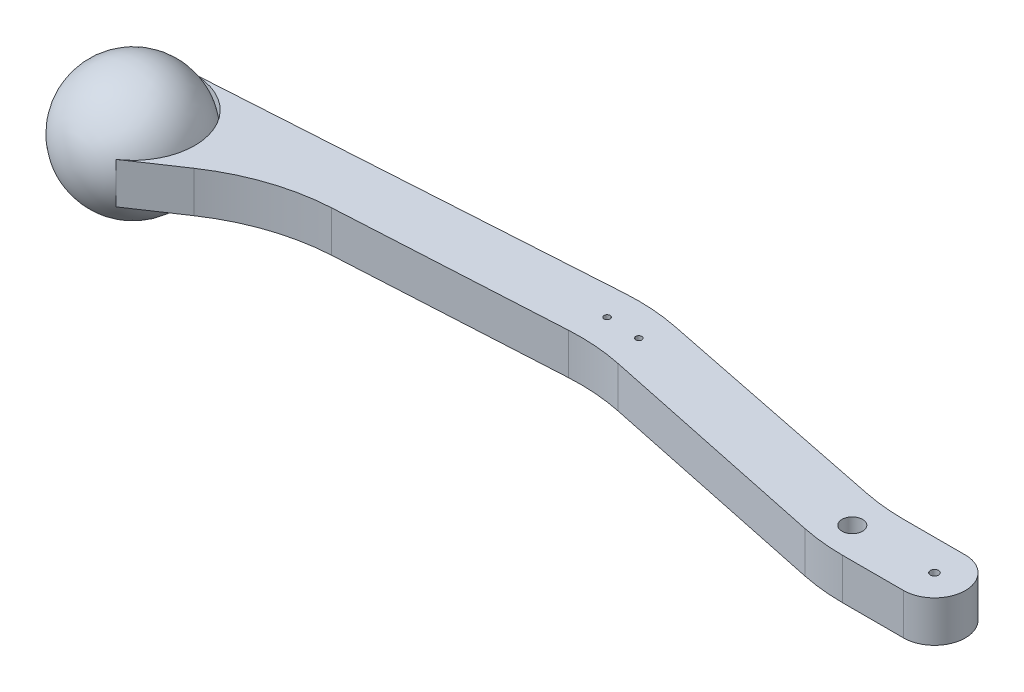
from build123d import *

# Parameters (mm, degrees)
BOSS_EXTRUDE1_DEPTH      = 10
BOSS_EXTRUDE1_DEPTH_BACK = 10
SKETCH1_R                = 5
SKETCH1_R_2              = 2
FILLET1_R                = 100
SKETCH2_R                = 1.5
CUT_EXTRUDE1_DEPTH       = 10
CUT_EXTRUDE2_DEPTH       = 10
CUT_EXTRUDE2_DEPTH_BACK  = 10
SKETCH3_R                = 30


with BuildPart() as part:
    # Sketch1 → Boss-Extrude1 (new, two sides: drawn at the far end of the back side and taken through both)
    with BuildSketch(Plane(origin=(0, 0, 0), x_dir=(1, 0, 0), z_dir=(0, 1, 0)).offset(-BOSS_EXTRUDE1_DEPTH_BACK)):
        with BuildLine():
            Line((-138.053278996, 13.889014505), (-5.919683, -13.782501703))
            Line((-5.919683, -13.782501703), (0, -15))
            Line((0, -15), (40, -15))
            ThreePointArc((40, -15), (55, 0), (40, 15))
            Line((40, 15), (0, 15))
            Line((0, 15), (-139.784941349, 43.225909045))
            Line((-139.784941349, 43.225909045), (-351.875415017, 29.941322925))
            ThreePointArc((-351.875415017, 29.941322925), (-378.412739548, -9.628926804), (-333.285739517, -24.912516864))
            Line((-333.285739517, -24.912516864), (-287.823465989, 5.588948968))
            Line((-287.823465989, 5.588948968), (-138.053278996, 13.889014505))
        make_face()
        Circle(SKETCH1_R, mode=Mode.SUBTRACT)
        with Locations((40, 0)):
            Circle(SKETCH1_R_2, mode=Mode.SUBTRACT)
    extrude(amount=BOSS_EXTRUDE1_DEPTH + BOSS_EXTRUDE1_DEPTH_BACK)

    # Fillet1
    fillet1_edges = [part.edges().sort_by_distance(p)[0] for p in [
        (0, 0, -15),
        (-139.784941349, 0, -43.225909045),
        (-138.053278996, 0, -13.889014505),
        (-287.823465989, 0, -5.588948968),
        (0, 0, 15),
    ]]
    fillet(fillet1_edges, radius=FILLET1_R)

    # Sketch2 → Cut-Extrude1 (cut)
    with BuildSketch(Plane(origin=(0, 10, 0), x_dir=(1, 0, 0), z_dir=(0, 1, 0))):
        with Locations((-147.336246923, 28.050603479)):
            Circle(SKETCH2_R)
        with Locations((-130.791911053, 26.905656844)):
            Circle(SKETCH2_R)
        with Locations((-364.746711272, 9.415773639)):
            Circle(SKETCH2_R)
        with Locations((-348.032450789, -15.496743225)):
            Circle(SKETCH2_R)
    extrude(amount=-CUT_EXTRUDE1_DEPTH, mode=Mode.SUBTRACT)

    # Sketch3 → Cut-Extrude2 (cut, two sides: drawn at the far end of the back side and taken through both)
    with BuildSketch(Plane(origin=(0, 0, 0), x_dir=(1, 0, 0), z_dir=(0, 1, 0)).offset(-CUT_EXTRUDE2_DEPTH_BACK)):
        with Locations((-350, 0)):
            Circle(SKETCH3_R)
    extrude(amount=CUT_EXTRUDE2_DEPTH + CUT_EXTRUDE2_DEPTH_BACK, mode=Mode.SUBTRACT)


with BuildPart() as body_2:
    # Sketch4 → Revolve6 (revolve)
    with BuildSketch(Plane(origin=(0, 0, 0), x_dir=(1, 0, 0), z_dir=(0, 1, 0))):
        with BuildLine():
            Line((-350, 30), (-350, -30))
            ThreePointArc((-350, -30), (-380, 0), (-350, 30))
        make_face()
    revolve(axis=Axis((-350, 0, -30), (0, 0, 1)))


solid = Compound([part.part, body_2.part])
